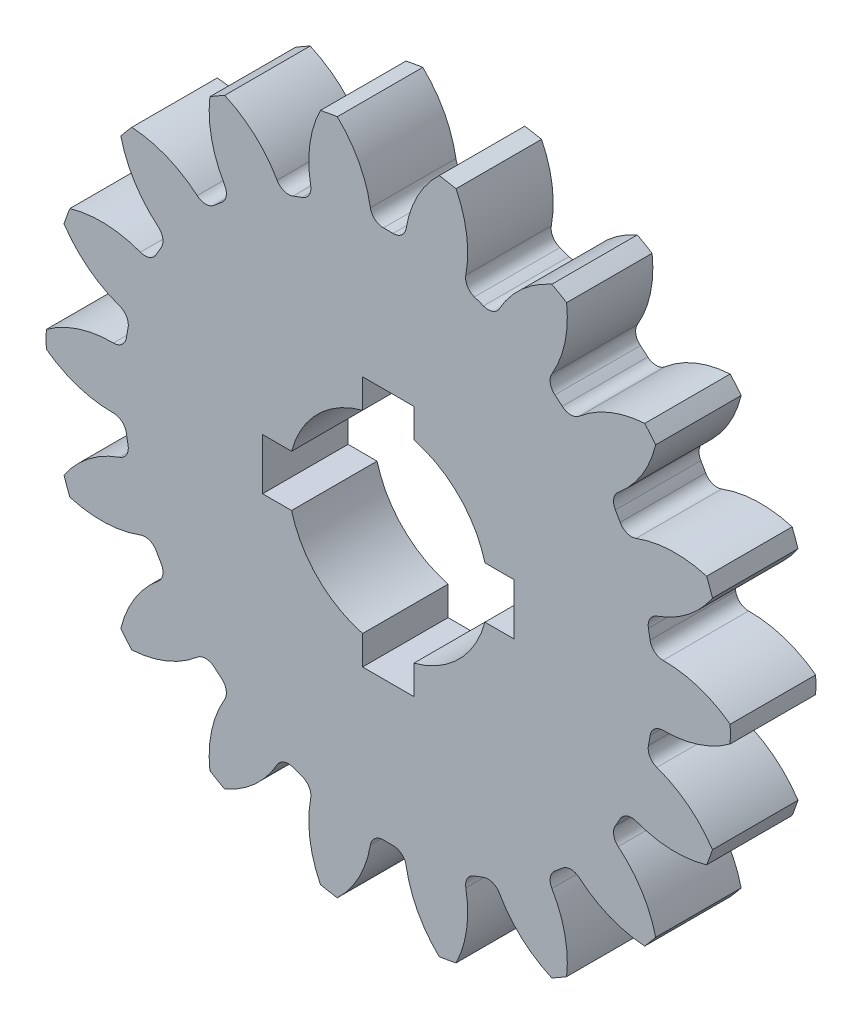
from build123d import *

# Parameters (mm, degrees)
SKETCH1_R                = 20
BOSS_EXTRUDE1_DEPTH      = 5
CUT_EXTRUDE1_DEPTH       = 10
FILLET2_R                = 0.76
CIRPATTERN2_COUNT        = 18
FILLET2_OF_CIRPATTERN2_R = 0.76
CUT_EXTRUDE2_DEPTH       = 5


with BuildPart() as part:
    # Sketch1 → Boss-Extrude1 (new body)
    with BuildSketch(Plane.XY):
        Circle(SKETCH1_R)
    extrude(amount=-BOSS_EXTRUDE1_DEPTH)

    # Sketch1<4> → Cut-Extrude1 (cut)
    with BuildSketch(Plane.XY):
        with BuildLine():
            ThreePointArc((-0.968956913, 15.469683982), (0, 15.5), (0.968956913, 15.469683982))
            ThreePointArc((0.968956913, 15.469683982), (1.566556505, 17.813553599), (2.979512846, 19.776817317))
            ThreePointArc((2.979512846, 19.776817317), (0, 20), (-2.979512846, 19.776817317))
            ThreePointArc((-2.979512846, 19.776817317), (-1.566556505, 17.813553599), (-0.968956913, 15.469683982))
        make_face()
    cut_extrude1 = extrude(amount=-CUT_EXTRUDE1_DEPTH, mode=Mode.SUBTRACT)

    # Fillet2
    fillet2_edges = [part.edges().sort_by_distance(p)[0] for p in [
        (0.968956913, 15.469683982, -2.5),
        (-0.968956913, 15.469683982, -2.5),
    ]]
    fillet(fillet2_edges, radius=FILLET2_R)

    # CirPattern2: Cut-Extrude1 ×18 about axis
    cirpattern2_axis = Axis((0, 0, 0), (0, 0, 1))
    for i in range(1, CIRPATTERN2_COUNT):
        add(cut_extrude1.rotate(cirpattern2_axis, i * 360 / CIRPATTERN2_COUNT), mode=Mode.SUBTRACT)

    # Fillet2 of CirPattern2
    fillet2_of_cirpattern2_edges = [part.edges().sort_by_distance(p)[0] for p in [
        (-4.380421872, 14.868150666, -2.5),
        (-6.201465193, 14.205345102, -2.5),
        (-9.201457131, 12.473298949, -2.5),
        (-10.685985248, 11.227631953, -2.5),
        (-12.912660861, 8.573983293, -2.5),
        (-13.881617773, 6.895700689, -2.5),
        (-15.06640712, 3.640518713, -2.5),
        (-15.402922324, 1.732046153, -2.5),
        (-15.402922324, -1.732046153, -2.5),
        (-15.06640712, -3.640518713, -2.5),
        (-13.881617773, -6.895700689, -2.5),
        (-12.912660861, -8.573983293, -2.5),
        (-10.685985248, -11.227631953, -2.5),
        (-9.201457131, -12.473298949, -2.5),
        (-6.201465193, -14.205345102, -2.5),
        (-4.380421872, -14.868150666, -2.5),
        (-0.968956913, -15.469683982, -2.5),
        (0.968956913, -15.469683982, -2.5),
        (4.380421872, -14.868150666, -2.5),
        (6.201465193, -14.205345102, -2.5),
        (9.201457131, -12.473298949, -2.5),
        (10.685985248, -11.227631953, -2.5),
        (12.912660861, -8.573983293, -2.5),
        (13.881617773, -6.895700689, -2.5),
        (15.06640712, -3.640518713, -2.5),
        (15.402922324, -1.732046153, -2.5),
        (15.402922324, 1.732046153, -2.5),
        (15.06640712, 3.640518713, -2.5),
        (13.881617773, 6.895700689, -2.5),
        (12.912660861, 8.573983293, -2.5),
        (10.685985248, 11.227631953, -2.5),
        (9.201457131, 12.473298949, -2.5),
        (6.201465193, 14.205345102, -2.5),
        (4.380421872, 14.868150666, -2.5),
    ]]
    fillet(fillet2_of_cirpattern2_edges, radius=FILLET2_OF_CIRPATTERN2_R)

    # Sketch2 → Cut-Extrude2 (cut)
    with BuildSketch(Plane.XY):
        with BuildLine():
            Line((-1.5, 5.652839314), (-1.5, 7.348469228))
            Line((-1.5, 7.348469228), (1.5, 7.348469228))
            Line((1.5, 7.348469228), (1.5, 5.652839314))
            ThreePointArc((1.5, 5.652839314), (4.135492251, 4.135492251), (5.652839314, 1.5))
            Line((5.652839314, 1.5), (7.348469228, 1.5))
            Line((7.348469228, 1.5), (7.348469228, -1.5))
            Line((7.348469228, -1.5), (5.652839314, -1.5))
            ThreePointArc((5.652839314, -1.5), (4.135492251, -4.135492251), (1.5, -5.652839314))
            Line((1.5, -5.652839314), (1.5, -7.348469228))
            Line((1.5, -7.348469228), (-1.5, -7.348469228))
            Line((-1.5, -7.348469228), (-1.5, -5.652839314))
            ThreePointArc((-1.5, -5.652839314), (-4.135492251, -4.135492251), (-5.652839314, -1.5))
            Line((-5.652839314, -1.5), (-7.348469228, -1.5))
            Line((-7.348469228, -1.5), (-7.348469228, 1.5))
            Line((-7.348469228, 1.5), (-5.652839314, 1.5))
            ThreePointArc((-5.652839314, 1.5), (-4.135492251, 4.135492251), (-1.5, 5.652839314))
        make_face()
    extrude(amount=-CUT_EXTRUDE2_DEPTH, mode=Mode.SUBTRACT)


solid = part.part
